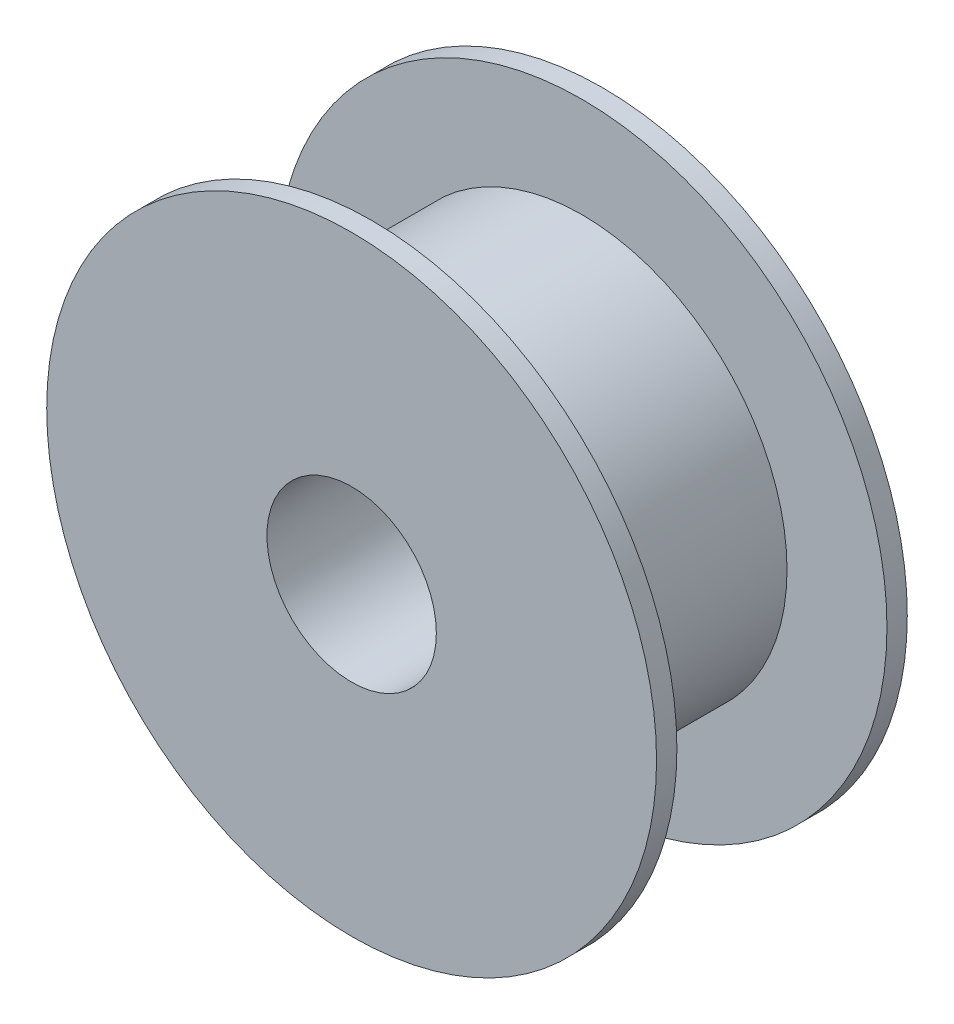
from build123d import *

# Parameters (mm, degrees)
SKETCH_1_R          = 6.05
SKETCH_1_R_2        = 2.5
EXTRUDE_1_DEPTH     = 7.4
SKETCH_2_R          = 9
EXTRUDE_2_DEPTH     = 0.6
EXTRUDE_START       = -0.6
SKETCH_3_R          = 9
EXTRUDE_3_DEPTH     = 0.6
SKETCH_4_R          = 2.5
CUT_EXTRUDE_1_DEPTH = 15.722771478


with BuildPart() as part:
    # Эскиз1 → Бобышка-Вытянуть1 (new body)
    with BuildSketch(Plane.XY):
        Circle(SKETCH_1_R)
        Circle(SKETCH_1_R_2, mode=Mode.SUBTRACT)
    extrude(amount=EXTRUDE_1_DEPTH)

    # Эскиз2 → Бобышка-Вытянуть2 (add)
    with BuildSketch(Plane.XY.offset(7.4)):
        Circle(SKETCH_2_R)
    extrude(amount=-EXTRUDE_2_DEPTH)

    # Эскиз3 → Бобышка-Вытянуть3 (add)
    with BuildSketch(Plane(origin=(0, 0, 0), x_dir=(-1, 0, 0), z_dir=(0, 0, -1)).offset(EXTRUDE_START)):
        with Locations(Location((0, 0, 0), (0, 0, 180))):
            Circle(SKETCH_3_R)
    extrude(amount=EXTRUDE_3_DEPTH)

    # Эскиз4 → Вырез-Вытянуть1 (cut, through all)
    with BuildSketch(Plane.XY.offset(7.4)):
        Circle(SKETCH_4_R)
    extrude(amount=-CUT_EXTRUDE_1_DEPTH, mode=Mode.SUBTRACT)


solid = part.part
